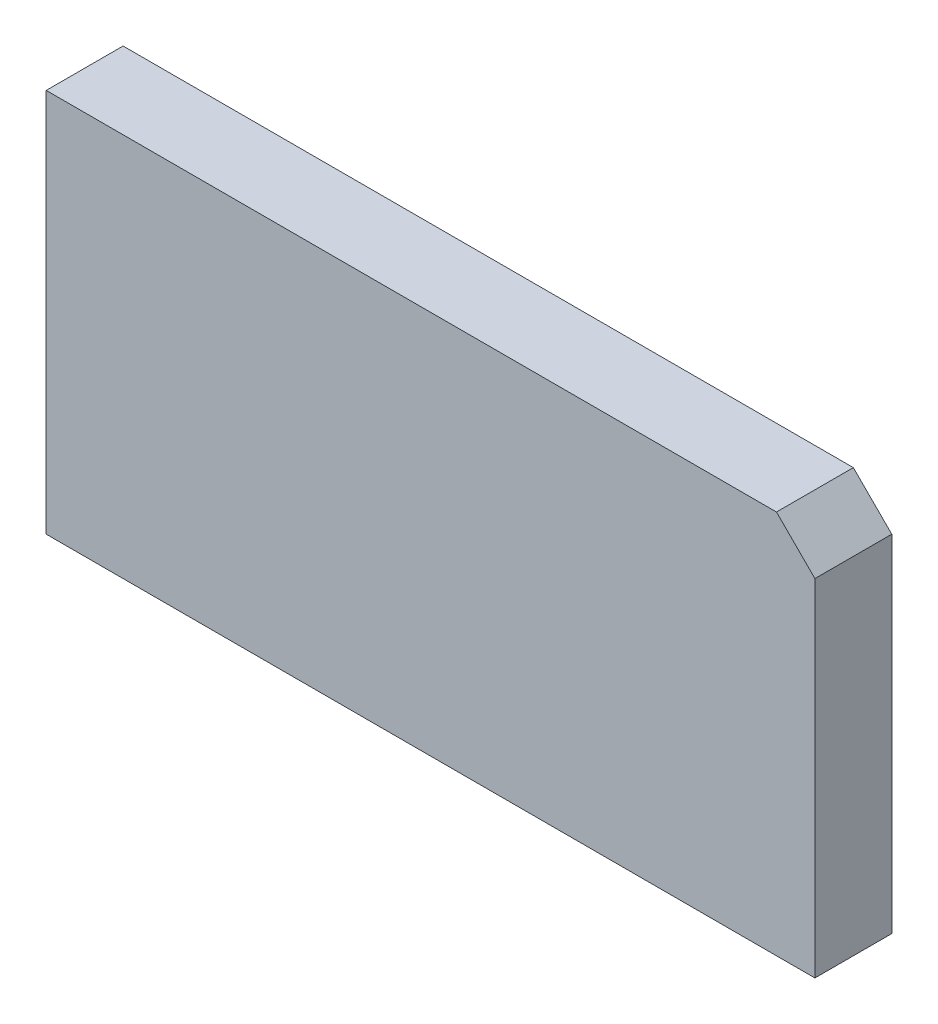
from build123d import *

# Parameters (mm, degrees)
SKETCH1_W           = 2000
SKETCH1_H           = 1000
BOSS_EXTRUDE1_DEPTH = 200
CUT_EXTRUDE1_DEPTH  = 200


with BuildPart() as part:
    # Sketch1 → Boss-Extrude1 (new body)
    with BuildSketch(Plane.XY):
        Rectangle(SKETCH1_W, SKETCH1_H)
    extrude(amount=-BOSS_EXTRUDE1_DEPTH)

    # Sketch2 → Cut-Extrude1 (cut)
    with BuildSketch(Plane.XY):
        Polygon((900, 500), (1000, 400), (1000, 500), align=None)
    extrude(amount=-CUT_EXTRUDE1_DEPTH, mode=Mode.SUBTRACT)


solid = part.part
